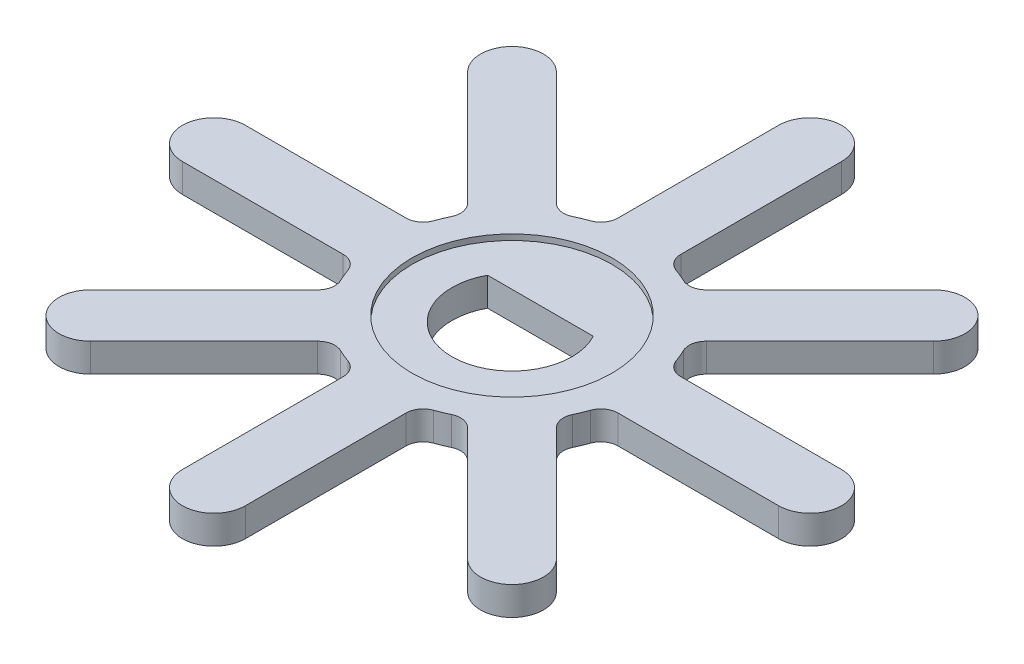
from build123d import *
from build123d.topology import SkipClean

# Parameters (mm, degrees)
BOSS_EXTRUDE1_DEPTH = 6.35
FILLET1_R           = 3.81
SKETCH2_R           = 22.225
CUT_EXTRUDE1_DEPTH  = 1.27
CUT_EXTRUDE2_DEPTH  = 104.696794015
BOSS_EXTRUDE3_DEPTH = 1.27


with BuildPart() as part:
    # Sketch1 → Boss-Extrude1 (new body)
    with BuildSketch(Plane(origin=(0, 0, 0), x_dir=(1, 0, 0), z_dir=(0, 1, 0))):
        with BuildLine():
            Line((-6.985, 66.251666667), (-6.985, 27.708128771))
            ThreePointArc((-6.985, 27.708128771), (-10.93517908, 26.399857642), (-14.653464881, 24.531746615))
            Line((-14.653464881, 24.531746615), (-41.907861898, 51.786143631))
            ThreePointArc((-41.907861898, 51.786143631), (-51.786143631, 51.786143631), (-51.786143631, 41.907861898))
            Line((-51.786143631, 41.907861898), (-24.531746615, 14.653464881))
            ThreePointArc((-24.531746615, 14.653464881), (-26.399857642, 10.93517908), (-27.708128771, 6.985))
            Line((-27.708128771, 6.985), (-66.251666667, 6.985))
            ThreePointArc((-66.251666667, 6.985), (-73.236666667, 0), (-66.251666667, -6.985))
            Line((-66.251666667, -6.985), (-27.708128771, -6.985))
            ThreePointArc((-27.708128771, -6.985), (-26.399857642, -10.93517908), (-24.531746615, -14.653464881))
            Line((-24.531746615, -14.653464881), (-51.786143631, -41.907861898))
            ThreePointArc((-51.786143631, -41.907861898), (-51.786143631, -51.786143631), (-41.907861898, -51.786143631))
            Line((-41.907861898, -51.786143631), (-14.653464881, -24.531746615))
            ThreePointArc((-14.653464881, -24.531746615), (-10.93517908, -26.399857642), (-6.985, -27.708128771))
            Line((-6.985, -27.708128771), (-6.985, -66.251666667))
            ThreePointArc((-6.985, -66.251666667), (0, -73.236666667), (6.985, -66.251666667))
            Line((6.985, -66.251666667), (6.985, -27.708128771))
            ThreePointArc((6.985, -27.708128771), (10.93517908, -26.399857642), (14.653464881, -24.531746615))
            Line((14.653464881, -24.531746615), (41.907861898, -51.786143631))
            ThreePointArc((41.907861898, -51.786143631), (51.786143631, -51.786143631), (51.786143631, -41.907861898))
            Line((51.786143631, -41.907861898), (24.531746615, -14.653464881))
            ThreePointArc((24.531746615, -14.653464881), (26.399857642, -10.93517908), (27.708128771, -6.985))
            Line((27.708128771, -6.985), (66.251666667, -6.985))
            ThreePointArc((66.251666667, -6.985), (73.236666667, 0), (66.251666667, 6.985))
            Line((66.251666667, 6.985), (27.708128771, 6.985))
            ThreePointArc((27.708128771, 6.985), (26.399857642, 10.93517908), (24.531746615, 14.653464881))
            Line((24.531746615, 14.653464881), (51.786143631, 41.907861898))
            ThreePointArc((51.786143631, 41.907861898), (51.786143631, 51.786143631), (41.907861898, 51.786143631))
            Line((41.907861898, 51.786143631), (14.653464881, 24.531746615))
            ThreePointArc((14.653464881, 24.531746615), (10.93517908, 26.399857642), (6.985, 27.708128771))
            Line((6.985, 27.708128771), (6.985, 66.251666667))
            ThreePointArc((6.985, 66.251666667), (0, 73.236666667), (-6.985, 66.251666667))
        make_face()
    extrude(amount=BOSS_EXTRUDE1_DEPTH)

    # Fillet1
    fillet1_edges = [part.edges().sort_by_distance(p)[0] for p in [
        (6.985, 3.175, -27.708128771),
        (14.653464881, 3.175, -24.531746615),
        (24.531746615, 3.175, -14.653464881),
        (27.708128771, 3.175, -6.985),
        (27.708128771, 3.175, 6.985),
        (24.531746615, 3.175, 14.653464881),
        (14.653464881, 3.175, 24.531746615),
        (6.985, 3.175, 27.708128771),
        (-6.985, 3.175, 27.708128771),
        (-14.653464881, 3.175, 24.531746615),
        (-24.531746615, 3.175, 14.653464881),
        (-27.708128771, 3.175, 6.985),
        (-27.708128771, 3.175, -6.985),
        (-24.531746615, 3.175, -14.653464881),
        (-14.653464881, 3.175, -24.531746615),
        (-6.985, 3.175, -27.708128771),
    ]]
    fillet(fillet1_edges, radius=FILLET1_R)

    # Sketch2 → Cut-Extrude1 (cut)
    with BuildSketch(Plane(origin=(0, 6.35, 0), x_dir=(1, 0, 0), z_dir=(0, 1, 0))):
        with Locations(Location((0, 0, 0), (0, 0, 270))):
            Circle(SKETCH2_R)
    extrude(amount=-CUT_EXTRUDE1_DEPTH, mode=Mode.SUBTRACT)

    # Sketch3 → Cut-Extrude2 (cut, through all)
    with BuildSketch(Plane(origin=(0, 5.08, 0), x_dir=(1, 0, 0), z_dir=(0, 1, 0))):
        with BuildLine():
            Line((-11.7475, 6.310187695), (11.7475, 6.310187695))
            ThreePointArc((11.7475, 6.310187695), (0, -13.335), (-11.7475, 6.310187695))
        make_face()
    extrude(amount=-CUT_EXTRUDE2_DEPTH, mode=Mode.SUBTRACT)

    # Sketch4 → Boss-Extrude3 (add)
    with SkipClean():  # the faces are left unmerged after this step: merging them gives an invalid solid
        with BuildSketch(Plane.XZ):
            with BuildLine():
                Line((-13.0175, -11.157764953), (13.0175, -11.157764953))
                ThreePointArc((13.0175, -11.157764953), (0, 17.145), (-13.0175, -11.157764953))
            make_face()
            with BuildLine():
                Line((11.7475, -6.310187695), (-11.7475, -6.310187695))
                ThreePointArc((-11.7475, -6.310187695), (0, 13.335), (11.7475, -6.310187695))
            make_face(mode=Mode.SUBTRACT)
        extrude(amount=BOSS_EXTRUDE3_DEPTH)


solid = part.part
